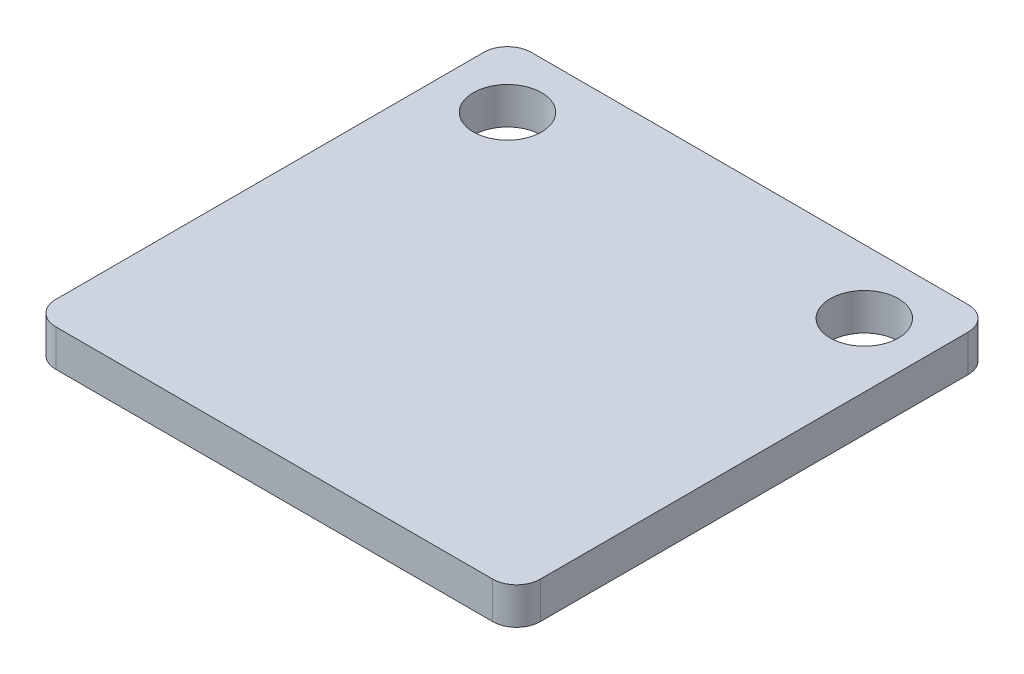
from build123d import *

# Parameters (mm, degrees)
SKETCH1_W               = 20.38
SKETCH1_H               = 20
BOSS_EXTRUDE1_DEPTH     = 0.775
CUT_EXTRUDE1_DEPTH      = 15.361009714
CUT_EXTRUDE1_DEPTH_BACK = 15.361009714
SKETCH2_R               = 1.435
FILLET1_R               = 1
SKETCH3_W               = 2
SKETCH3_H               = 2.56
BOSS_EXTRUDE2_DEPTH     = 0.5


with BuildPart() as part:
    # Sketch1 → Boss-Extrude1 (new, symmetric)
    with BuildSketch(Plane(origin=(0, 0, 0), x_dir=(1, 0, 0), z_dir=(0, 1, 0))):
        Rectangle(SKETCH1_W, SKETCH1_H)
    extrude(amount=BOSS_EXTRUDE1_DEPTH, both=True)

    # Sketch2 → Cut-Extrude1 (cut, two sides: drawn at the far end of the back side and taken through both)
    with BuildSketch(Plane(origin=(0, 0.775, 0), x_dir=(1, 0, 0), z_dir=(0, 1, 0)).offset(-CUT_EXTRUDE1_DEPTH_BACK)):
        with Locations(Location((-7.505, 7.315, 0), (0, 0, 270))):
            Circle(SKETCH2_R)
        with Locations(Location((7.505, 7.315, 0), (0, 0, 270))):
            Circle(SKETCH2_R)
    extrude(amount=CUT_EXTRUDE1_DEPTH + CUT_EXTRUDE1_DEPTH_BACK, mode=Mode.SUBTRACT)

    # Fillet1
    fillet1_edges = [part.edges().sort_by_distance(p)[0] for p in [
        (10.19, 0, 10),
        (-10.19, 0, 10),
        (-10.19, 0, -10),
        (10.19, 0, -10),
    ]]
    fillet(fillet1_edges, radius=FILLET1_R)

    # Sketch3 → Boss-Extrude2 (add)
    with BuildSketch(Plane(origin=(0, -0.775, 0), x_dir=(-1, 0, 0), z_dir=(0, -1, 0))):
        Rectangle(SKETCH3_W, SKETCH3_H)
    extrude(amount=BOSS_EXTRUDE2_DEPTH)


solid = part.part
